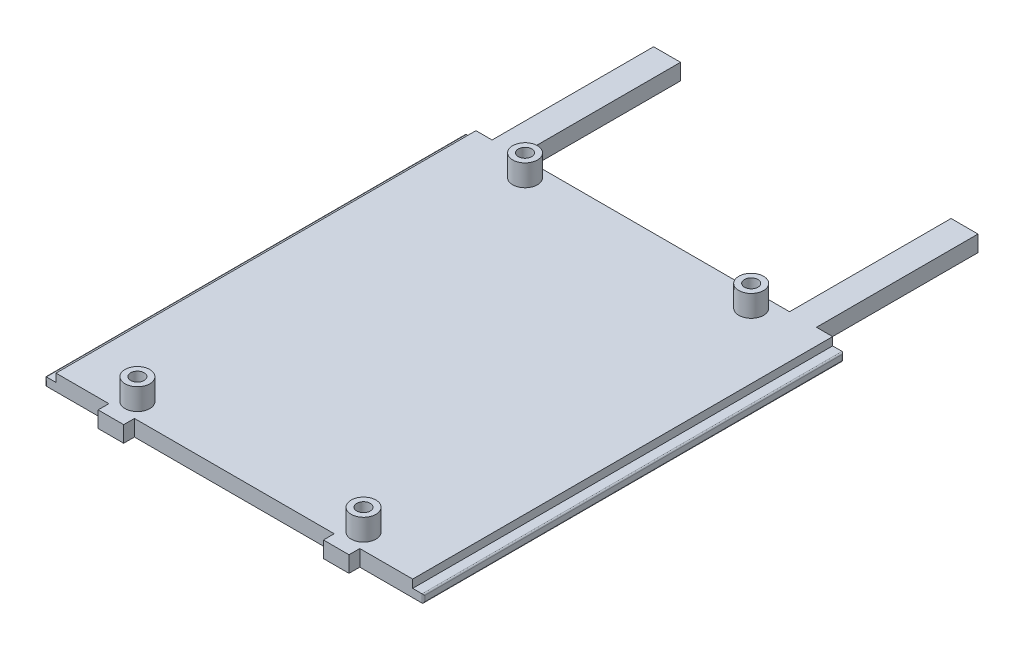
from build123d import *

# Parameters (mm, degrees)
SKETCH1_W           = 66.25
SKETCH1_H           = 78
SKETCH1_R           = 1.25
BOSS_EXTRUDE1_DEPTH = 3
SKETCH2_W           = 9.747388218
SKETCH2_H           = 78
SKETCH2_W_2         = 10.388237
BOSS_EXTRUDE2_DEPTH = 1.5
FILLET2_R           = 0.25
FILLET3_R           = 0.25
SKETCH3_R           = 2.3
SKETCH3_R_2         = 1.25
BOSS_EXTRUDE3_DEPTH = 4
SKETCH4_W           = 4.75
SKETCH4_H           = 3
BOSS_EXTRUDE4_DEPTH = 2
SKETCH5_W           = 5
SKETCH5_H           = 3
BOSS_EXTRUDE5_DEPTH = 30


with BuildPart() as part:
    # Sketch1 → Boss-Extrude1 (new body)
    with BuildSketch(Plane(origin=(0, 0, 0), x_dir=(1, 0, 0), z_dir=(0, 1, 0))):
        Rectangle(SKETCH1_W, SKETCH1_H)
        with Locations(Location((-21, 36, 0), (0, 0, 270))):
            Circle(SKETCH1_R, mode=Mode.SUBTRACT)
        with Locations(Location((21, 36, 0), (0, 0, 90))):
            Circle(SKETCH1_R, mode=Mode.SUBTRACT)
        with Locations(Location((21, -36, 0), (0, 0, 270))):
            Circle(SKETCH1_R, mode=Mode.SUBTRACT)
        with Locations(Location((-21, -36, 0), (0, 0, 90))):
            Circle(SKETCH1_R, mode=Mode.SUBTRACT)
    extrude(amount=BOSS_EXTRUDE1_DEPTH)

    # Sketch2 → Boss-Extrude2 (add)
    with BuildSketch(Plane.XZ):
        with Locations((-30.251305891, 0)):
            Rectangle(SKETCH2_W, SKETCH2_H)
        with Locations((29.9308815, 0)):
            Rectangle(SKETCH2_W_2, SKETCH2_H)
    extrude(amount=-BOSS_EXTRUDE2_DEPTH)

    # Fillet2
    fillet2_edges = [part.edges().sort_by_distance(p)[0] for p in [
        (-35.125, 0.75, 39),
        (-35.125, 0, 0),
        (-35.125, 1.5, 0),
        (-35.125, 0.75, -39),
    ]]
    fillet(fillet2_edges, radius=FILLET2_R)

    # Fillet3
    fillet3_edges = [part.edges().sort_by_distance(p)[0] for p in [
        (35.125, 0.75, -39),
        (35.125, 0, 0),
        (35.125, 1.5, 0),
        (35.125, 0.75, 39),
    ]]
    fillet(fillet3_edges, radius=FILLET3_R)

    # Sketch3 → Boss-Extrude3 (add)
    # profile 1 of 4: a face of its own
    with BuildSketch(Plane(origin=(0, 3, 0), x_dir=(1, 0, 0), z_dir=(0, 1, 0))):
        with Locations(Location((-21, 36, 0), (0, 0, 270))):
            Circle(SKETCH3_R)
        with Locations(Location((-21, 36, 0), (0, 0, 270))):
            Circle(SKETCH3_R_2, mode=Mode.SUBTRACT)
    # profile 2 of 4: a face of its own
    with BuildSketch(Plane(origin=(0, 3, 0), x_dir=(1, 0, 0), z_dir=(0, 1, 0))):
        with Locations(Location((21, 36, 0), (0, 0, 90))):
            Circle(SKETCH3_R)
        with Locations(Location((21, 36, 0), (0, 0, 90))):
            Circle(SKETCH3_R_2, mode=Mode.SUBTRACT)
    # profile 3 of 4: a face of its own
    with BuildSketch(Plane(origin=(0, 3, 0), x_dir=(1, 0, 0), z_dir=(0, 1, 0))):
        with Locations(Location((21, -36, 0), (0, 0, 270))):
            Circle(SKETCH3_R)
        with Locations(Location((21, -36, 0), (0, 0, 270))):
            Circle(SKETCH3_R_2, mode=Mode.SUBTRACT)
    # profile 4 of 4: a face of its own
    with BuildSketch(Plane(origin=(0, 3, 0), x_dir=(1, 0, 0), z_dir=(0, 1, 0))):
        with Locations(Location((-21, -36, 0), (0, 0, 90))):
            Circle(SKETCH3_R)
        with Locations(Location((-21, -36, 0), (0, 0, 90))):
            Circle(SKETCH3_R_2, mode=Mode.SUBTRACT)
    extrude(amount=BOSS_EXTRUDE3_DEPTH)

    # Sketch4 → Boss-Extrude4 (add)
    with BuildSketch(Plane.XY.offset(39)):
        with Locations((-20.925, 1.5)):
            Rectangle(SKETCH4_W, SKETCH4_H)
        with Locations((20.925, 1.5)):
            Rectangle(SKETCH4_W, SKETCH4_H)
    extrude(amount=BOSS_EXTRUDE4_DEPTH)

    # Sketch5 → Boss-Extrude5 (add)
    with BuildSketch(Plane(origin=(0, 0, -39), x_dir=(-1, 0, 0), z_dir=(0, 0, -1))):
        with Locations((-27.625, 1.5)):
            Rectangle(SKETCH5_W, SKETCH5_H)
        with Locations((27.625, 1.5)):
            Rectangle(SKETCH5_W, SKETCH5_H)
    extrude(amount=BOSS_EXTRUDE5_DEPTH)


solid = part.part
